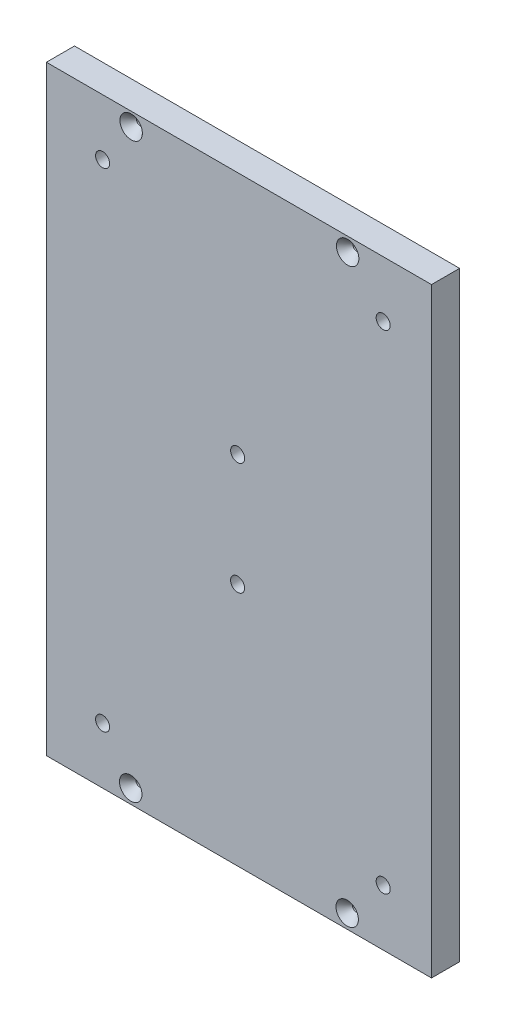
from build123d import *

# Parameters (mm, degrees)
SKETCH1_W                   = 174.021305966
SKETCH1_H                   = 271.365530146
BOSS_EXTRUDE1_DEPTH         = 12.7
F_1_4_0_25_DIAMETER_HOLE1_D = 6.35
HOLE1_D                     = 3.175
HOLE1_DEPTH                 = 31.75
HOLE1_CSINK_D               = 10.16
HOLE1_CSINK_ANGLE           = 82
HOLE1_TIP                   = 0.953866233


with BuildPart() as part:
    # Sketch1 → Boss-Extrude1 (new body)
    with BuildSketch(Plane.XY):
        with Locations((212.253144626, 135.682765073)):
            Rectangle(SKETCH1_W, SKETCH1_H)
    extrude(amount=BOSS_EXTRUDE1_DEPTH)

    # 1/4 (0.25) Diameter Hole1 (through all)
    with Locations(Plane(origin=(0, 0, 0), x_dir=(-1, 0, 0), z_dir=(0, 0, -1))):
        with Locations((-277.426568305, 245.965530146), (-211.653264176, 161.082765073), (-150.642491643, 245.965530146), (-211.653264176, 110.282765073), (-277.426568305, 25.4), (-150.642491643, 25.4)):
            Hole(F_1_4_0_25_DIAMETER_HOLE1_D / 2)

    # Hole1
    with Locations(Plane(origin=(-499.672124507, 135.816741379, 12.7), x_dir=(0, -1, 0), z_dir=(0, 0, 1))):
        with Locations((-129.257383629, 761.035393152), (129.466741379, 663.01461615), (129.466741379, 760.835922116), (-129.408220012, 663.214203478)):
            CounterSinkHole(HOLE1_D / 2, HOLE1_CSINK_D / 2, depth=HOLE1_DEPTH, counter_sink_angle=HOLE1_CSINK_ANGLE)
            with Locations((0, 0, -(HOLE1_DEPTH + HOLE1_TIP / 2))):  # 118° drill point
                Cone(0, HOLE1_D / 2, HOLE1_TIP, mode=Mode.SUBTRACT)


solid = part.part
